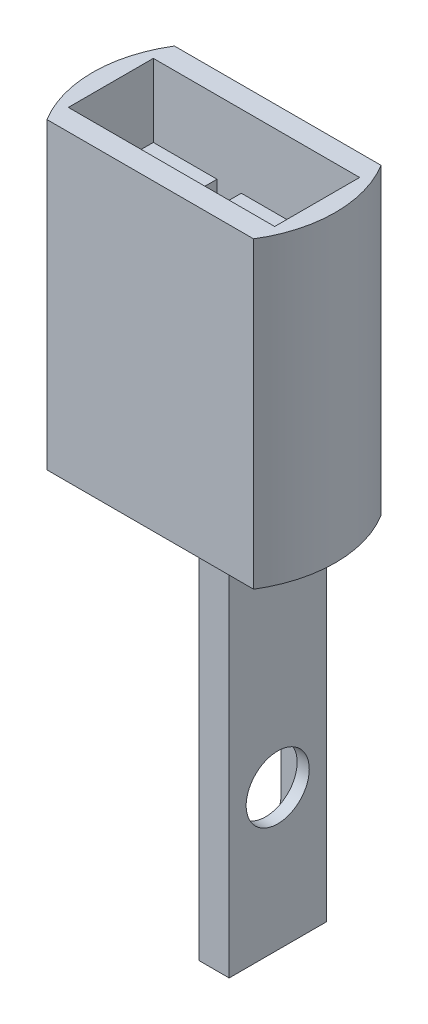
from build123d import *

# Parameters (mm, degrees)
SKETCH3_R           = 10
BOSS_EXTRUDE1_DEPTH = 25
SKETCH4_W           = 2.5
SKETCH4_H           = 8
BOSS_EXTRUDE2_DEPTH = 30
CUT_EXTRUDE1_REACH  = 37.108
SKETCH5_R           = 2.6
SKETCH6_W           = 5.5
SKETCH6_H           = 21
CUT_EXTRUDE2_DEPTH  = 1.5
SKETCH7_W           = 17
SKETCH7_H           = 7
CUT_EXTRUDE3_DEPTH  = 6
SKETCH8_W           = 2
SKETCH8_H           = 7
CUT_EXTRUDE4_DEPTH  = 4
BOSS_EXTRUDE3_DEPTH = 1.5
CUT_EXTRUDE5_REACH  = 35.166


with BuildPart() as part:
    # Sketch3 → Boss-Extrude1 (new body)
    with BuildSketch(Plane(origin=(0, 0, 0), x_dir=(1, 0, 0), z_dir=(0, 1, 0))):
        with Locations(Location((0, 0, 0), (0, 0, 270))):
            Circle(SKETCH3_R)
    extrude(amount=BOSS_EXTRUDE1_DEPTH)

    # Sketch4 → Boss-Extrude2 (add)
    with BuildSketch(Plane(origin=(0, 0, 0), x_dir=(-1, 0, 0), z_dir=(0, -1, 0))):
        with Locations((-4, 0)):
            Rectangle(SKETCH4_W, SKETCH4_H)
    extrude(amount=BOSS_EXTRUDE2_DEPTH)

    # Sketch5 → Cut-Extrude1 (cut, up to next)
    with BuildSketch(Plane(origin=(5.25, 0, 0), x_dir=(0, 0, -1), z_dir=(1, 0, 0)), mode=Mode.PRIVATE) as cut_extrude1_sk1:
        with Locations((0, -18.4)):
            Circle(SKETCH5_R)
    cut_extrude1_tool1 = extrude(cut_extrude1_sk1.sketch, amount=-CUT_EXTRUDE1_REACH, mode=Mode.PRIVATE) & part.part
    add(cut_extrude1_tool1.solids().sort_by_distance((5.25, -18.4, 0))[0], mode=Mode.SUBTRACT)

    # Sketch6 → Cut-Extrude2 (cut)
    with BuildSketch(Plane.ZY.offset(-2.75)):
        with Locations((0, -18.4)):
            Rectangle(SKETCH6_W, SKETCH6_H)
    extrude(amount=-CUT_EXTRUDE2_DEPTH, mode=Mode.SUBTRACT)

    # Sketch7 → Cut-Extrude3 (cut)
    with BuildSketch(Plane(origin=(0, 25, 0), x_dir=(1, 0, 0), z_dir=(0, 1, 0))):
        Rectangle(SKETCH7_W, SKETCH7_H)
    extrude(amount=-CUT_EXTRUDE3_DEPTH, mode=Mode.SUBTRACT)

    # Sketch8 → Cut-Extrude4 (cut)
    with BuildSketch(Plane(origin=(0, 19, 0), x_dir=(1, 0, 0), z_dir=(0, 1, 0))):
        with Locations((-2.25, 0)):
            Rectangle(SKETCH8_W, SKETCH8_H)
    extrude(amount=-CUT_EXTRUDE4_DEPTH, mode=Mode.SUBTRACT)

    # Sketch9 → Boss-Extrude3 (add)
    with BuildSketch(Plane.ZY.offset(-4.25)):
        Polygon((-2.75, -28.9), (-2.75, -21.9), (-1.5, -28.9), align=None)
        Polygon((1.5, -28.9), (2.75, -28.9), (2.75, -21.9), align=None)
        Polygon((2.75, -7.9), (2.75, -14.9), (1.5, -7.9), align=None)
        Polygon((-1.5, -7.9), (-2.75, -7.9), (-2.75, -14.9), align=None)
    extrude(amount=BOSS_EXTRUDE3_DEPTH)

    # Sketch11 → Cut-Extrude5 (cut, up to next)
    with BuildSketch(Plane(origin=(0, 0, 0), x_dir=(-1, 0, 0), z_dir=(0, -1, 0)), mode=Mode.PRIVATE) as cut_extrude5_sk1:
        with BuildLine():
            Line((8.511022265, 5.25), (-8.511022265, 5.25))
            ThreePointArc((-8.511022265, 5.25), (0, 10), (8.511022265, 5.25))
        make_face()
    cut_extrude5_tool1 = extrude(cut_extrude5_sk1.sketch, amount=-CUT_EXTRUDE5_REACH, mode=Mode.PRIVATE) & part.part
    # Sketch11 → Cut-Extrude5 (cut, up to next)
    with BuildSketch(Plane(origin=(0, 0, 0), x_dir=(-1, 0, 0), z_dir=(0, -1, 0)), mode=Mode.PRIVATE) as cut_extrude5_sk2:
        with BuildLine():
            Line((8.511022265, -5.25), (-8.511022265, -5.25))
            ThreePointArc((-8.511022265, -5.25), (0, -10), (8.511022265, -5.25))
        make_face()
    cut_extrude5_tool2 = extrude(cut_extrude5_sk2.sketch, amount=-CUT_EXTRUDE5_REACH, mode=Mode.PRIVATE) & part.part
    add(cut_extrude5_tool1.solids().sort_by_distance((0, 0, -7.194917))[0], mode=Mode.SUBTRACT)
    add(cut_extrude5_tool2.solids().sort_by_distance((0, 0, 7.194917))[0], mode=Mode.SUBTRACT)


solid = part.part
